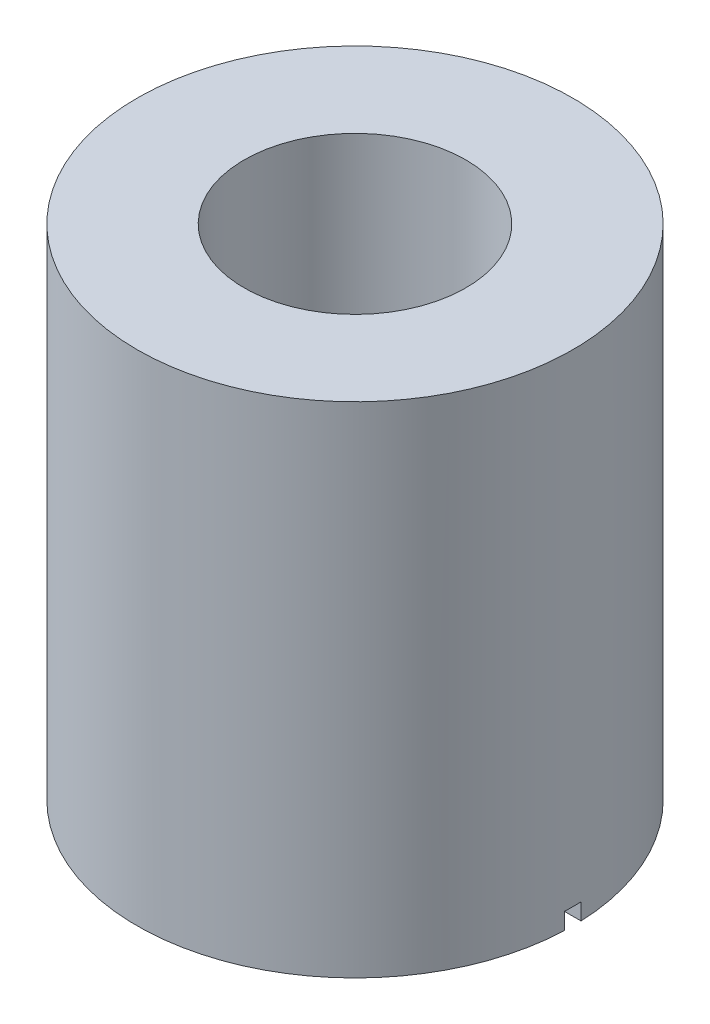
from build123d import *

# Parameters (mm, degrees)
SKETCH_1_R          = 19.65
SKETCH_1_R_2        = 10
EXTRUDE_1_DEPTH     = 45
SKETCH_2_R          = 10
SKETCH_2_R_2        = 0.5
EXTRUDE_2_DEPTH     = 18
SKETCH_3_R          = 16
CUT_EXTRUDE_1_DEPTH = 5
SKETCH_5_W          = 1.5
SKETCH_5_H          = 1.5
CUT_EXTRUDE_2_DEPTH = 63.5


with BuildPart() as part:
    # 草图1 → 凸台-拉伸1 (new body)
    with BuildSketch(Plane(origin=(0, 0, 0), x_dir=(1, 0, 0), z_dir=(0, 1, 0))):
        Circle(SKETCH_1_R)
        Circle(SKETCH_1_R_2, mode=Mode.SUBTRACT)
    extrude(amount=EXTRUDE_1_DEPTH)

    # 草图2 → 凸台-拉伸2 (add)
    with BuildSketch(Plane.XZ):
        Circle(SKETCH_2_R)
        Circle(SKETCH_2_R_2, mode=Mode.SUBTRACT)
    extrude(amount=-EXTRUDE_2_DEPTH)

    # 草图3 → 切除-拉伸1 (cut)
    with BuildSketch(Plane.XZ):
        Circle(SKETCH_3_R)
    extrude(amount=-CUT_EXTRUDE_1_DEPTH, mode=Mode.SUBTRACT)

    # 草图5 → 切除-拉伸2 (cut, symmetric)
    with BuildSketch(Plane(origin=(0, 45, 0), x_dir=(0, 0, 1), z_dir=(-1, 0, 0))):
        with Locations((0, -44.25)):
            Rectangle(SKETCH_5_W, SKETCH_5_H)
    extrude(amount=CUT_EXTRUDE_2_DEPTH, both=True, mode=Mode.SUBTRACT)


solid = part.part
